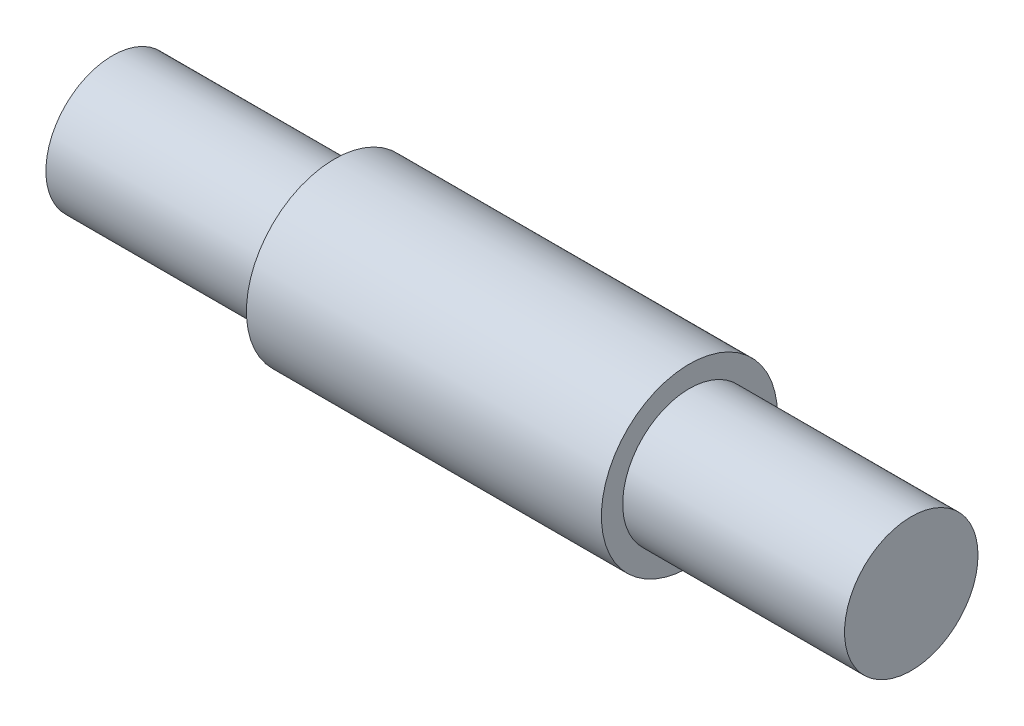
from build123d import *

# Parameters (mm, degrees)
SKETCH1_R           = 3.1496
BOSS_EXTRUDE1_DEPTH = 14.2875
SKETCH3_R           = 3.1496
SKETCH3_R_2         = 2.3876
CUT_EXTRUDE2_DEPTH  = 7.9375


with BuildPart() as part:
    # Sketch1 → Boss-Extrude1 (new, symmetric)
    with BuildSketch(Plane(origin=(0, 0, 0), x_dir=(0, 0, -1), z_dir=(1, 0, 0))):
        Circle(SKETCH1_R)
    extrude(amount=BOSS_EXTRUDE1_DEPTH, both=True)

    # Sketch3 → Cut-Extrude2 (cut)
    with BuildSketch(Plane(origin=(14.2875, 0, 0), x_dir=(0, 0, -1), z_dir=(1, 0, 0))):
        Circle(SKETCH3_R)
        Circle(SKETCH3_R_2, mode=Mode.SUBTRACT)
    cut_extrude2 = extrude(amount=-CUT_EXTRUDE2_DEPTH, mode=Mode.SUBTRACT)

    # Mirror1: Cut-Extrude2 across plane
    add(cut_extrude2.mirror(Plane(origin=(0, 0, 0), x_dir=(0, 0, 1), z_dir=(1, 0, 0))), mode=Mode.SUBTRACT)


solid = part.part
